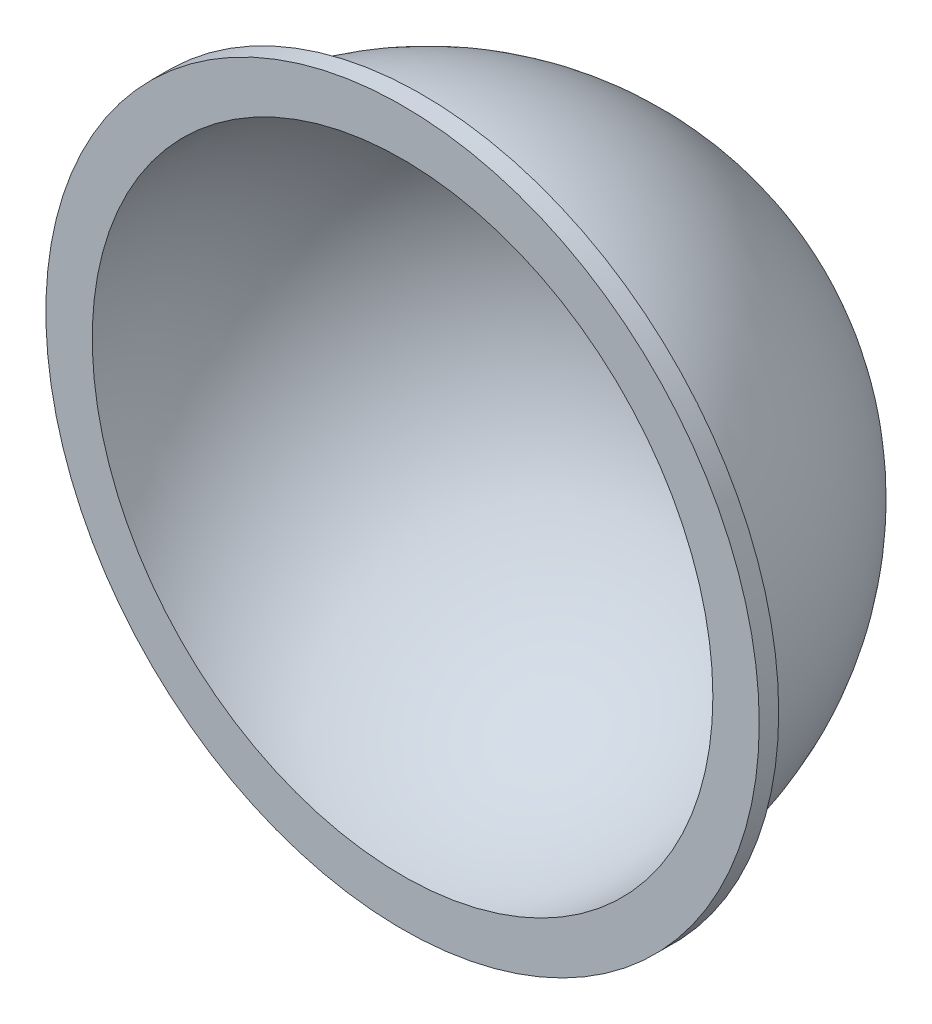
from build123d import *


with BuildPart() as part:
    # Sketch2 → Revolve1 (revolve)
    with BuildSketch(Plane(origin=(0, 0, 0), x_dir=(1, 0, 0), z_dir=(0, 1, 0)), mode=Mode.PRIVATE) as revolve1_sk:
        with BuildLine():
            Line((-55, 0), (-47.848127564, 0))
            ThreePointArc((-47.848127564, 0), (-33.630686879, 32.742457185), (0, 44.708284453))
            Line((0, 44.708284453), (0, 55))
            ThreePointArc((0, 55), (-35.472152697, 39.069377594), (-50, 3))
            Line((-50, 3), (-55, 3))
            Line((-55, 3), (-55, 0))
        make_face()
    revolve(revolve1_sk.sketch.rotate(Axis((0, 0, 0), (0, 0, -1)), 180), axis=Axis((0, 0, 0), (0, 0, -1)))


solid = part.part
